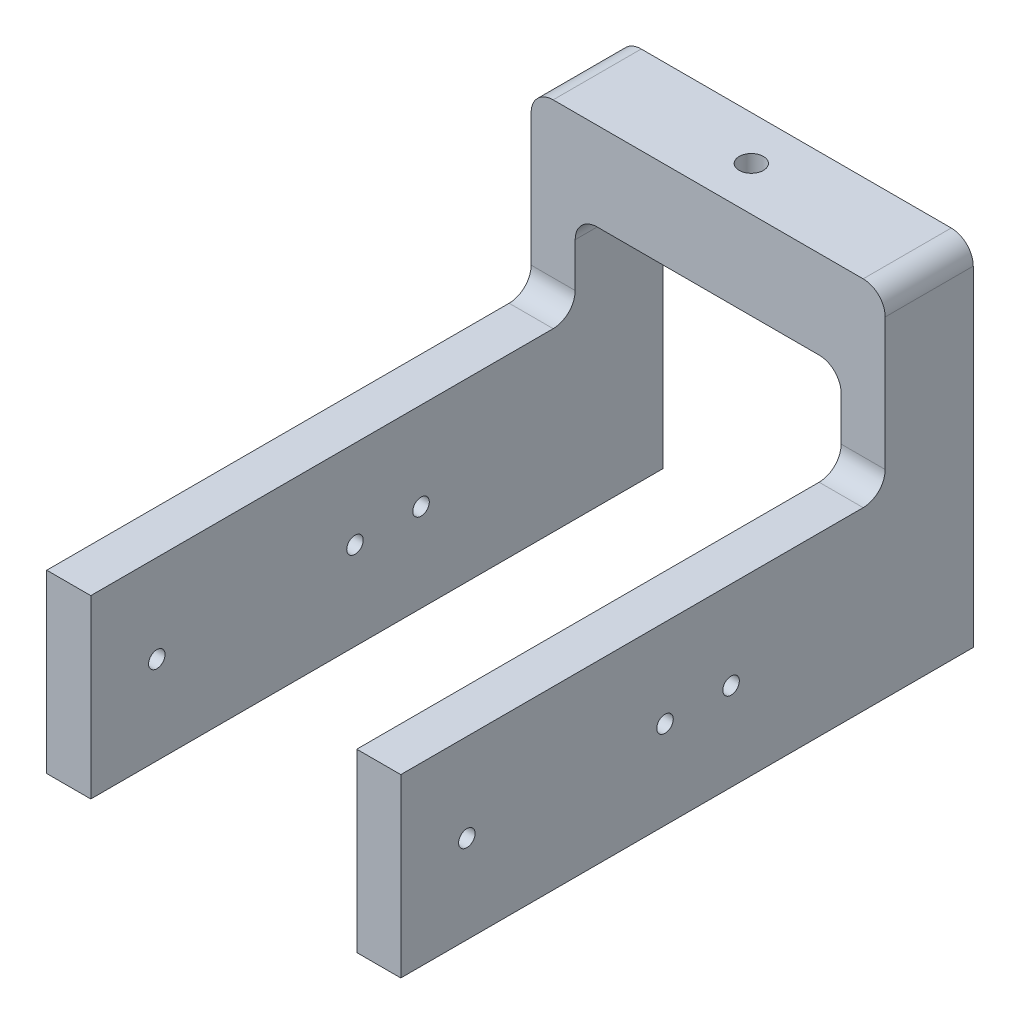
from build123d import *

# Parameters (mm, degrees)
BOSS_EXTRUDE1_DEPTH   = 102.108
SKETCH2_W             = 76.708
SKETCH2_H             = 76.2
CUT_EXTRUDE1_DEPTH    = 220.104116036
F_7_0MM_DOWEL_HOLE1_D = 7
FILLET1_R             = 6.35
SKETCH5_R             = 2.38125
CUT_EXTRUDE2_DEPTH    = 220.104116036


with BuildPart() as part:
    # Sketch1 → Boss-Extrude1 (new body)
    with BuildSketch(Plane(origin=(0, 0, 0), x_dir=(0, 0, -1), z_dir=(1, 0, 0))):
        Polygon((0, 0), (-165.1, 0), (-165.1, 50.8), (-25.4, 50.8), (-25.4, 101.6), (0, 101.6), align=None)
    extrude(amount=BOSS_EXTRUDE1_DEPTH)

    # Sketch2 → Cut-Extrude1 (cut, through all)
    with BuildSketch(Plane(origin=(0, 0, 0), x_dir=(-1, 0, 0), z_dir=(0, 0, -1))):
        with Locations((-51.054, 38.1)):
            Rectangle(SKETCH2_W, SKETCH2_H)
    extrude(amount=-CUT_EXTRUDE1_DEPTH, mode=Mode.SUBTRACT)

    # Ø7.0mm Dowel Hole1 (through all)
    with Locations(Plane(origin=(0, 101.6, 0), x_dir=(1, 0, 0), z_dir=(0, 1, 0))):
        with Locations((50.8, -12.7)):
            Hole(F_7_0MM_DOWEL_HOLE1_D / 2)

    # Fillet1
    fillet1_edges = [part.edges().sort_by_distance(p)[0] for p in [
        (95.758, 50.8, 25.4),
        (6.35, 50.8, 25.4),
        (89.408, 76.2, 12.7),
        (12.7, 76.2, 12.7),
        (0, 101.6, 12.7),
        (102.108, 101.6, 12.7),
    ]]
    fillet(fillet1_edges, radius=FILLET1_R)

    # Sketch5 → Cut-Extrude2 (cut, through all)
    with BuildSketch(Plane(origin=(102.108, 0, 0), x_dir=(0, 0, -1), z_dir=(1, 0, 0))):
        with Locations((-146.05, 25.4)):
            Circle(SKETCH5_R)
        with Locations((-88.9, 25.4)):
            Circle(SKETCH5_R)
        with Locations((-69.85, 25.4)):
            Circle(SKETCH5_R)
    extrude(amount=-CUT_EXTRUDE2_DEPTH, mode=Mode.SUBTRACT)


solid = part.part
